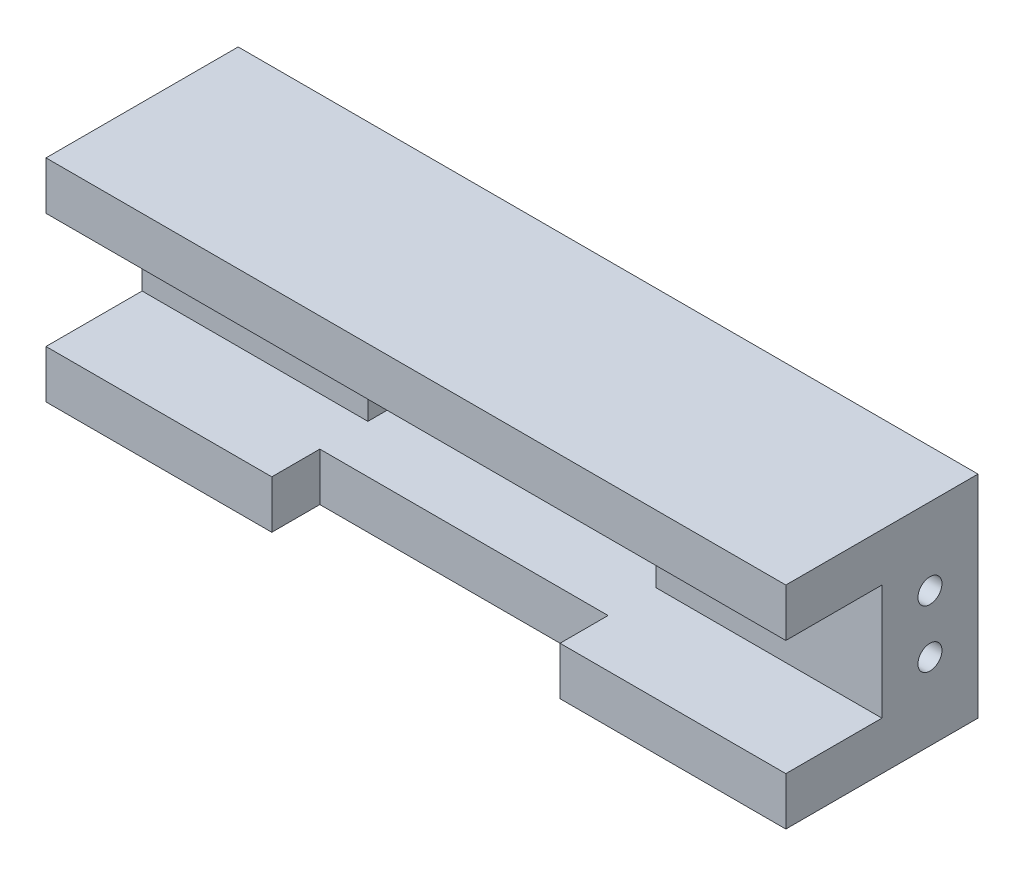
from build123d import *

# Parameters (mm, degrees)
SKETCH1_W           = 77
SKETCH1_H           = 12
BOSS_EXTRUDE1_DEPTH = 10
SKETCH2_R           = 1.25
CUT_EXTRUDE1_DEPTH  = 12
SKETCH3_W           = 77
SKETCH3_H           = 20
BOSS_EXTRUDE2_DEPTH = 5
SKETCH4_W           = 30
SKETCH4_H           = 6
CUT_EXTRUDE2_DEPTH  = 10
SKETCH5_W           = 30
SKETCH5_H           = 2.5
CUT_EXTRUDE3_DEPTH  = 5


with BuildPart() as part:
    # Sketch1 → Boss-Extrude1 (new body)
    with BuildSketch(Plane.XY):
        with Locations((38.5, 6)):
            Rectangle(SKETCH1_W, SKETCH1_H)
    extrude(amount=BOSS_EXTRUDE1_DEPTH)

    # Sketch2 → Cut-Extrude1 (cut)
    with BuildSketch(Plane(origin=(77, 0, 0), x_dir=(0, 0, -1), z_dir=(1, 0, 0))):
        with Locations((-5, 3)):
            Circle(SKETCH2_R)
        with Locations((-5, 9)):
            Circle(SKETCH2_R)
    cut_extrude1 = extrude(amount=-CUT_EXTRUDE1_DEPTH, mode=Mode.SUBTRACT)

    # Mirror1: Cut-Extrude1 across plane
    add(cut_extrude1.mirror(Plane.ZY.offset(-38.5)), mode=Mode.SUBTRACT)

    # Sketch3 → Boss-Extrude2 (add)
    with BuildSketch(Plane(origin=(0, 12, 0), x_dir=(1, 0, 0), z_dir=(0, 1, 0))):
        with Locations((38.5, -10)):
            Rectangle(SKETCH3_W, SKETCH3_H)
    boss_extrude2 = extrude(amount=BOSS_EXTRUDE2_DEPTH)

    # Mirror2: Boss-Extrude2 across plane
    add(boss_extrude2.mirror(Plane(origin=(0, 6, 0), x_dir=(0, 0, 1), z_dir=(0, -1, 0))))

    # Sketch4 → Cut-Extrude2 (cut)
    with BuildSketch(Plane(origin=(0, 0, 0), x_dir=(-1, 0, 0), z_dir=(0, 0, -1))):
        with Locations((-38.5, 9)):
            Rectangle(SKETCH4_W, SKETCH4_H)
        with Locations((-38.5, 3)):
            Rectangle(SKETCH4_W, SKETCH4_H)
    extrude(amount=-CUT_EXTRUDE2_DEPTH, mode=Mode.SUBTRACT)

    # Sketch5 → Cut-Extrude3 (cut)
    with BuildSketch(Plane.XY.offset(20)):
        with Locations((38.5, -1.25)):
            Rectangle(SKETCH5_W, SKETCH5_H)
        with Locations((38.5, -3.75)):
            Rectangle(SKETCH5_W, SKETCH5_H)
    extrude(amount=-CUT_EXTRUDE3_DEPTH, mode=Mode.SUBTRACT)


solid = part.part
